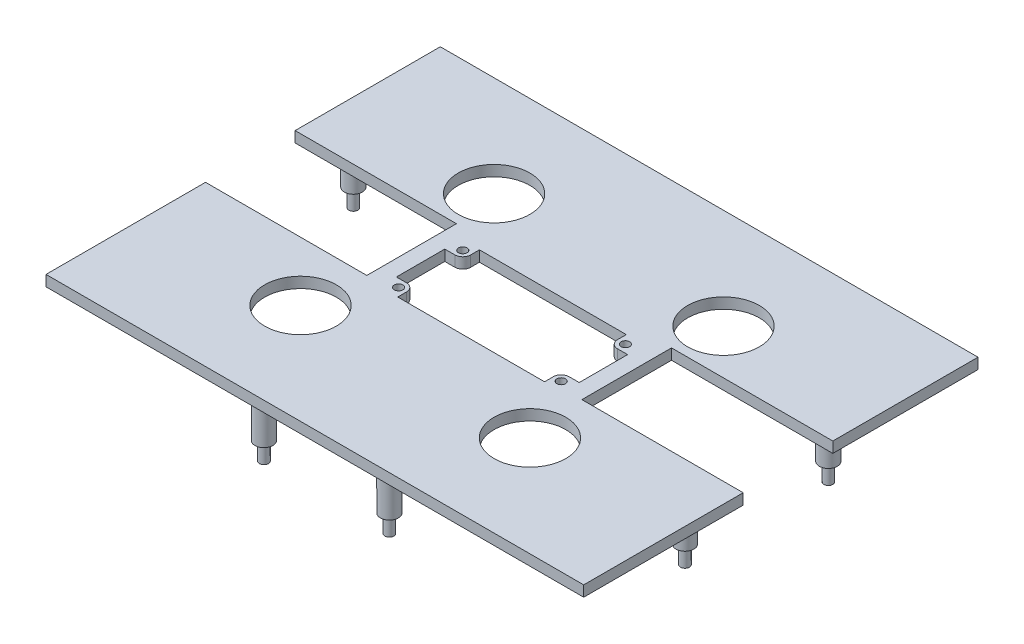
from build123d import *

# Parameters (mm, degrees)
SKETCH2_W           = 150
SKETCH2_H           = 110
BOSS_EXTRUDE1_DEPTH = 3
SKETCH3_R           = 2.5
BOSS_EXTRUDE2_DEPTH = 10
SKETCH4_R           = 1.25
BOSS_EXTRUDE3_DEPTH = 5
SKETCH5_W           = 45
SKETCH5_H           = 25
CUT_EXTRUDE1_DEPTH  = 3
SKETCH6_R           = 10
CUT_EXTRUDE2_DEPTH  = 3
SKETCH7_R           = 1.2
CUT_EXTRUDE3_DEPTH  = 3


with BuildPart() as part:
    # Sketch2 → Boss-Extrude1 (new body)
    with BuildSketch(Plane(origin=(0, 0, 0), x_dir=(1, 0, 0), z_dir=(0, 1, 0))):
        Rectangle(SKETCH2_W, SKETCH2_H)
    extrude(amount=-BOSS_EXTRUDE1_DEPTH)

    # Sketch3 → Boss-Extrude2 (add)
    with BuildSketch(Plane.XZ.offset(3)):
        with Locations(Location((-17.5, 51.7, 0), (0, 0, 90))):
            Circle(SKETCH3_R)
        with Locations(Location((17.5, 51.7, 0), (0, 0, 90))):
            Circle(SKETCH3_R)
        with Locations(Location((66.25, 18, 0), (0, 0, 90))):
            Circle(SKETCH3_R)
        with Locations(Location((66.25, -22, 0), (0, 0, 90))):
            Circle(SKETCH3_R)
        with Locations(Location((-66.25, 18, 0), (0, 0, 90))):
            Circle(SKETCH3_R)
        with Locations(Location((-66.25, -22, 0), (0, 0, 90))):
            Circle(SKETCH3_R)
    extrude(amount=BOSS_EXTRUDE2_DEPTH)

    # Sketch4 → Boss-Extrude3 (add)
    with BuildSketch(Plane.XZ.offset(13)):
        with Locations(Location((17.5, 51.7, 0), (0, 0, 270))):
            Circle(SKETCH4_R)
        with Locations(Location((-17.5, 51.7, 0), (0, 0, 270))):
            Circle(SKETCH4_R)
        with Locations(Location((-66.25, 18, 0), (0, 0, 270))):
            Circle(SKETCH4_R)
        with Locations(Location((-66.25, -22, 0), (0, 0, 270))):
            Circle(SKETCH4_R)
        with Locations(Location((66.25, -22, 0), (0, 0, 270))):
            Circle(SKETCH4_R)
        with Locations(Location((66.25, 18, 0), (0, 0, 270))):
            Circle(SKETCH4_R)
    extrude(amount=BOSS_EXTRUDE3_DEPTH)

    # Sketch5 → Cut-Extrude1 (cut)
    with BuildSketch(Plane(origin=(0, 0, 0), x_dir=(1, 0, 0), z_dir=(0, 1, 0))):
        with Locations((-52.5, 2)):
            Rectangle(SKETCH5_W, SKETCH5_H)
        with Locations((52.5, 2)):
            Rectangle(SKETCH5_W, SKETCH5_H)
    extrude(amount=-CUT_EXTRUDE1_DEPTH, mode=Mode.SUBTRACT)

    # Sketch6 → Cut-Extrude2 (cut)
    with BuildSketch(Plane(origin=(0, 0, 0), x_dir=(1, 0, 0), z_dir=(0, 1, 0))):
        with Locations(Location((-32, 27, 0), (0, 0, 270))):
            Circle(SKETCH6_R)
        with Locations(Location((-32, -27, 0), (0, 0, 270))):
            Circle(SKETCH6_R)
        with Locations(Location((32, -27, 0), (0, 0, 270))):
            Circle(SKETCH6_R)
        with Locations(Location((32, 27, 0), (0, 0, 270))):
            Circle(SKETCH6_R)
    extrude(amount=-CUT_EXTRUDE2_DEPTH, mode=Mode.SUBTRACT)

    # Sketch7 → Cut-Extrude3 (cut)
    with BuildSketch(Plane(origin=(0, 0, 0), x_dir=(1, 0, 0), z_dir=(0, 1, 0))):
        with Locations(Location((-22.68, 8.95, 0), (0, 0, 270))):
            Circle(SKETCH7_R)
        with Locations(Location((22.68, 8.95, 0), (0, 0, 270))):
            Circle(SKETCH7_R)
        with Locations(Location((22.68, -8.95, 0), (0, 0, 270))):
            Circle(SKETCH7_R)
        with Locations(Location((-22.68, -8.95, 0), (0, 0, 270))):
            Circle(SKETCH7_R)
        with BuildLine():
            Line((-20.48, 11.4), (20.48, 11.4))
            Line((20.48, 11.4), (20.48, 8.95))
            ThreePointArc((20.48, 8.95), (21.124365081, 7.394365081), (22.68, 6.75))
            Line((22.68, 6.75), (25.5, 6.75))
            Line((25.5, 6.75), (25.5, -6.75))
            Line((25.5, -6.75), (22.68, -6.75))
            ThreePointArc((22.68, -6.75), (21.124365081, -7.394365081), (20.48, -8.95))
            Line((20.48, -8.95), (20.48, -11.4))
            Line((20.48, -11.4), (-20.48, -11.4))
            Line((-20.48, -11.4), (-20.48, -8.95))
            ThreePointArc((-20.48, -8.95), (-21.124365081, -7.394365081), (-22.68, -6.75))
            Line((-22.68, -6.75), (-25.5, -6.75))
            Line((-25.5, -6.75), (-25.5, 6.75))
            Line((-25.5, 6.75), (-22.68, 6.75))
            ThreePointArc((-22.68, 6.75), (-21.124365081, 7.394365081), (-20.48, 8.95))
            Line((-20.48, 8.95), (-20.48, 11.4))
        make_face()
    extrude(amount=-CUT_EXTRUDE3_DEPTH, mode=Mode.SUBTRACT)


solid = part.part
